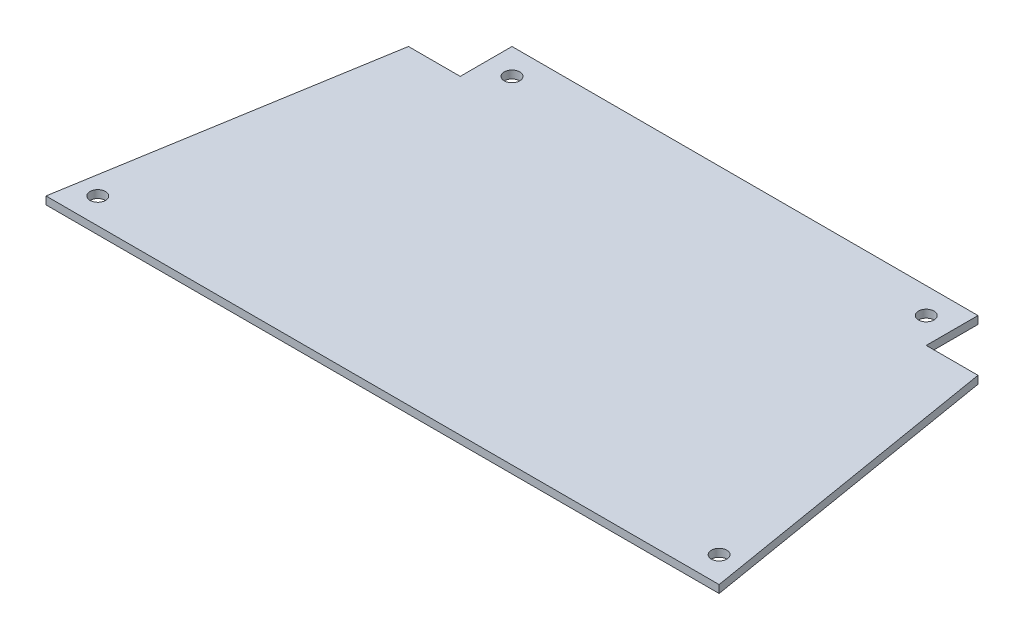
from build123d import *

# Parameters (mm, degrees)
Y_KSEKLIK_EKSTR_ZYON1_DEPTH = 1.5
IZIM2_R                     = 1.5
KES_EKSTR_ZYON1_DEPTH       = 10


with BuildPart() as part:
    # Çizim1 → Yükseklik-Ekstrüzyon1 (new body)
    with BuildSketch(Plane(origin=(0, 0, 0), x_dir=(1, 0, 0), z_dir=(0, 1, 0))):
        Polygon((0, 0), (130, 0), (120, 60), (110, 60), (110, 70), (20, 70), (20, 60), (10, 60), align=None)
    extrude(amount=Y_KSEKLIK_EKSTR_ZYON1_DEPTH)

    # Çizim2 → Kes-Ekstrüzyon1 (cut)
    with BuildSketch(Plane(origin=(0, 1.5, 0), x_dir=(1, 0, 0), z_dir=(0, 1, 0))):
        with Locations(Location((25, 65, 0), (0, 0, 270))):
            Circle(IZIM2_R)
        with Locations(Location((105, 65, 0), (0, 0, 270))):
            Circle(IZIM2_R)
        with Locations(Location((5, 5, 0), (0, 0, 270))):
            Circle(IZIM2_R)
        with Locations(Location((125, 5, 0), (0, 0, 270))):
            Circle(IZIM2_R)
    extrude(amount=-KES_EKSTR_ZYON1_DEPTH, mode=Mode.SUBTRACT)


solid = part.part
